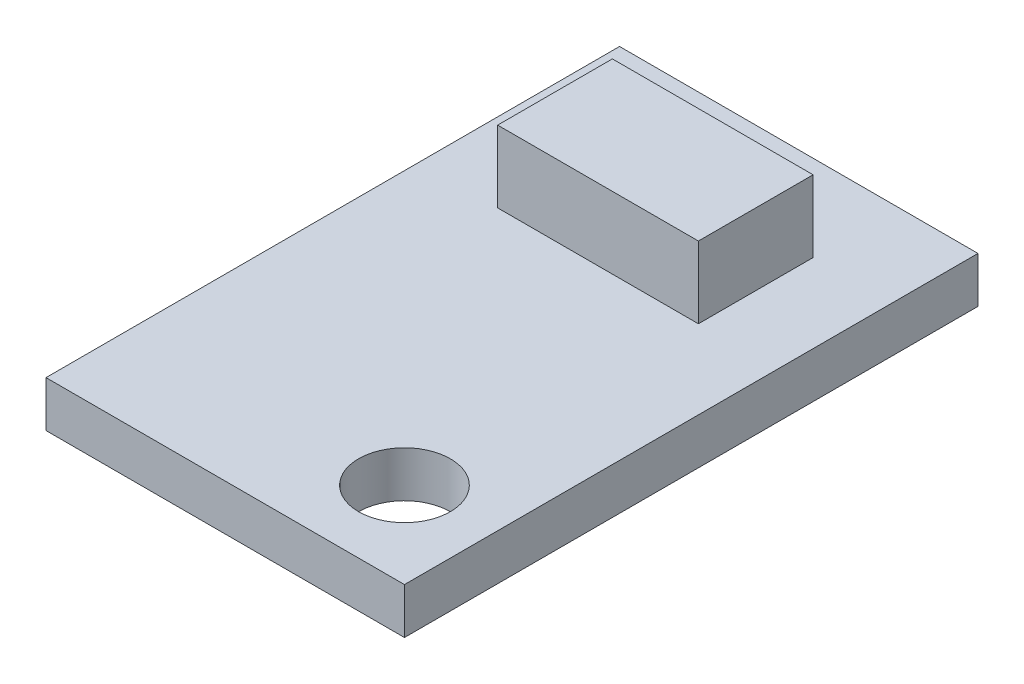
from build123d import *

# Parameters (mm, degrees)
SKETCH1_W           = 12.5
SKETCH1_H           = 20
SKETCH1_R           = 1.6
BOSS_EXTRUDE1_DEPTH = 1.6
SKETCH2_W           = 7
SKETCH2_H           = 4
BOSS_EXTRUDE2_DEPTH = 2.5


with BuildPart() as part:
    # Sketch1 → Boss-Extrude1 (new body)
    with BuildSketch(Plane(origin=(0, 0, 0), x_dir=(1, 0, 0), z_dir=(0, 1, 0))):
        with Locations((0, 10)):
            Rectangle(SKETCH1_W, SKETCH1_H)
        with Locations(Location((3.25, 3, 0), (0, 0, 270))):
            Circle(SKETCH1_R, mode=Mode.SUBTRACT)
    extrude(amount=BOSS_EXTRUDE1_DEPTH)

    # Sketch2 → Boss-Extrude2 (add)
    with BuildSketch(Plane(origin=(0, 1.6, 0), x_dir=(1, 0, 0), z_dir=(0, 1, 0))):
        with Locations((0, 15)):
            Rectangle(SKETCH2_W, SKETCH2_H)
    extrude(amount=BOSS_EXTRUDE2_DEPTH)


solid = part.part
